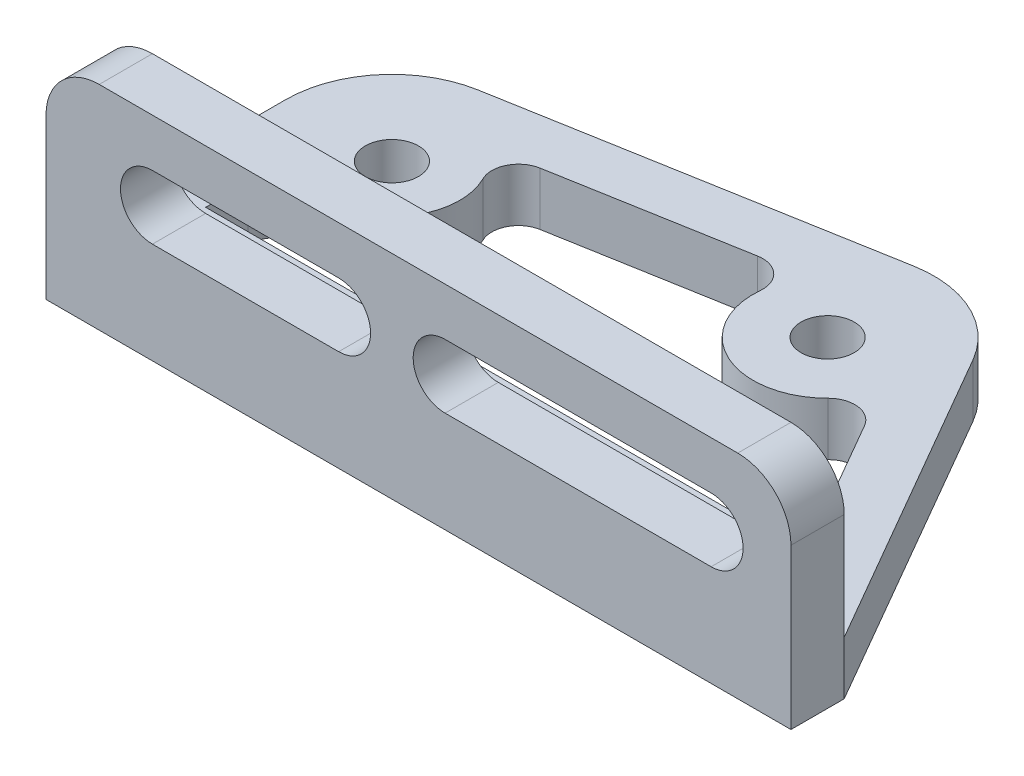
from build123d import *

# Parameters (mm, degrees)
SKETCH1_R                = 5
BOSS_EXTRUDE1_DEPTH      = 10
BOSS_EXTRUDE2_DEPTH      = 30
BOSS_EXTRUDE2_DEPTH_BACK = 10
SKETCH2_W                = 140
SKETCH2_H                = 10
CUT_EXTRUDE1_DEPTH       = 30
FILLET1_R                = 10


with BuildPart() as part:
    # Sketch1 → Boss-Extrude1 (new body)
    with BuildSketch(Plane(origin=(0, 0, 0), x_dir=(1, 0, 0), z_dir=(0, 1, 0))):
        with BuildLine():
            Line((0, 0), (0, 35))
            ThreePointArc((0, 35), (4.679111138, 47.855752194), (16.527036447, 54.69615506))
            Line((16.527036447, 54.69615506), (86.139090058, 66.970638294))
            ThreePointArc((86.139090058, 66.970638294), (98.064418846, 65.400638975), (106.932561687, 57.274483234))
            Line((106.932561687, 57.274483234), (140, 0))
            Line((140, 0), (0, 0))
        make_face()
        with Locations(Location((20, 35, 0), (0, 0, 270))):
            Circle(SKETCH1_R, mode=Mode.SUBTRACT)
        with Locations(Location((89.612053611, 47.274483234, 0), (0, 0, 270))):
            Circle(SKETCH1_R, mode=Mode.SUBTRACT)
        with BuildLine():
            Line((122.679491924, 10), (10, 10))
            Line((10, 10), (10, 17.962162855))
            ThreePointArc((10, 17.962162855), (12.003313152, 21.964645576), (16.407947174, 22.759837787))
            ThreePointArc((16.407947174, 22.759837787), (29.771929506, 26.800377555), (31.430453218, 40.662963335))
            ThreePointArc((31.430453218, 40.662963335), (31.448708001, 45.138764747), (35.042512339, 47.806666902))
            Line((35.042512339, 47.806666902), (69.815261378, 53.938040751))
            ThreePointArc((69.815261378, 53.938040751), (74.069509797, 52.692990027), (75.66252141, 48.556434103))
            ThreePointArc((75.66252141, 48.556434103), (83.691884517, 34.57863964), (99.560671411, 37.412543742))
            ThreePointArc((99.560671411, 37.412543742), (103.753425217, 38.851152942), (107.441767577, 36.39251276))
            Line((107.441767577, 36.39251276), (122.679491924, 10))
        make_face(mode=Mode.SUBTRACT)
    extrude(amount=BOSS_EXTRUDE1_DEPTH)

    # Sketch2 → Boss-Extrude2 (add, two sides: drawn at the far end of the back side and taken through both)
    with BuildSketch(Plane(origin=(0, 10, 0), x_dir=(1, 0, 0), z_dir=(0, 1, 0)).offset(-BOSS_EXTRUDE2_DEPTH_BACK)):
        with Locations((70, -5)):
            Rectangle(SKETCH2_W, SKETCH2_H)
    extrude(amount=BOSS_EXTRUDE2_DEPTH + BOSS_EXTRUDE2_DEPTH_BACK)

    # Sketch3 → Cut-Extrude1 (cut)
    with BuildSketch(Plane(origin=(0, 0, 0), x_dir=(-1, 0, 0), z_dir=(0, 0, -1))):
        with BuildLine():
            Line((-125, 31), (-75, 31))
            ThreePointArc((-75, 31), (-69, 25), (-75, 19))
            Line((-75, 19), (-125, 19))
            ThreePointArc((-125, 19), (-131, 25), (-125, 31))
        make_face()
        with BuildLine():
            Line((-55, 31), (-20, 31))
            ThreePointArc((-20, 31), (-14, 25), (-20, 19))
            Line((-20, 19), (-55, 19))
            ThreePointArc((-55, 19), (-61, 25), (-55, 31))
        make_face()
    extrude(amount=-CUT_EXTRUDE1_DEPTH, mode=Mode.SUBTRACT)

    # Fillet1
    fillet1_edges = [part.edges().sort_by_distance(p)[0] for p in [
        (0, 40, 5),
        (140, 40, 5),
    ]]
    fillet(fillet1_edges, radius=FILLET1_R)


solid = part.part
